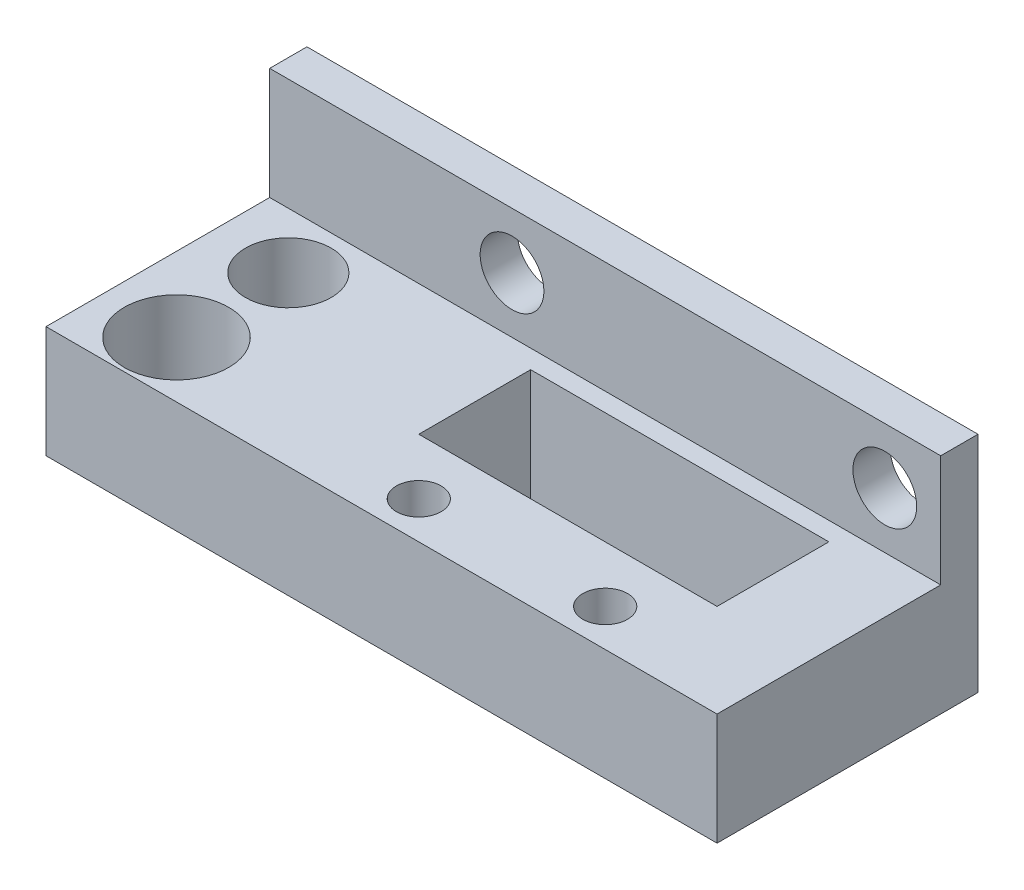
from build123d import *

# Parameters (mm, degrees)
SKETCH1_W           = 45.72
SKETCH1_H           = 17.78
BOSS_EXTRUDE1_DEPTH = 7.62
SKETCH2_W           = 45.72
SKETCH2_H           = 2.54
BOSS_EXTRUDE2_DEPTH = 7.62
SKETCH3_R           = 2.1717
CUT_EXTRUDE1_DEPTH  = 2.54
SKETCH4_R           = 3.556
SKETCH4_R_2         = 2.921
SKETCH4_R_3         = 1.524
SKETCH4_W           = 20.32
SKETCH4_H           = 7.62
CUT_EXTRUDE2_DEPTH  = 7.62


with BuildPart() as part:
    # Sketch1 → Boss-Extrude1 (new body)
    with BuildSketch(Plane(origin=(0, 0, 0), x_dir=(1, 0, 0), z_dir=(0, 1, 0))):
        with Locations((-7.464489796, 4.231173469)):
            Rectangle(SKETCH1_W, SKETCH1_H)
    extrude(amount=BOSS_EXTRUDE1_DEPTH)

    # Sketch2 → Boss-Extrude2 (add)
    with BuildSketch(Plane(origin=(0, 7.62, 0), x_dir=(1, 0, 0), z_dir=(0, 1, 0))):
        with Locations((-7.464489796, 11.851173469)):
            Rectangle(SKETCH2_W, SKETCH2_H)
    extrude(amount=BOSS_EXTRUDE2_DEPTH)

    # Sketch3 → Cut-Extrude1 (cut)
    with BuildSketch(Plane(origin=(0, 0, -13.121173469), x_dir=(-1, 0, 0), z_dir=(0, 0, -1))):
        with Locations((13.814489796, 11.43)):
            Circle(SKETCH3_R)
        with Locations((-11.585510204, 11.43)):
            Circle(SKETCH3_R)
    extrude(amount=-CUT_EXTRUDE1_DEPTH, mode=Mode.SUBTRACT)

    # Sketch4 → Cut-Extrude2 (cut)
    with BuildSketch(Plane(origin=(0, 7.62, 0), x_dir=(1, 0, 0), z_dir=(0, 1, 0))):
        with Locations(Location((-25.244489796, -0.848826531, 0), (0, 0, 270))):
            Circle(SKETCH4_R)
        with Locations(Location((-25.244489796, 6.771173469, 0), (0, 0, 270))):
            Circle(SKETCH4_R_2)
        with Locations(Location((-7.464489796, -2.118826531, 0), (0, 0, 270))):
            Circle(SKETCH4_R_3)
        with Locations(Location((5.235510204, -2.118826531, 0), (0, 0, 270))):
            Circle(SKETCH4_R_3)
        with Locations((-1.114489796, 5.501173469)):
            Rectangle(SKETCH4_W, SKETCH4_H)
    extrude(amount=-CUT_EXTRUDE2_DEPTH, mode=Mode.SUBTRACT)


solid = part.part
